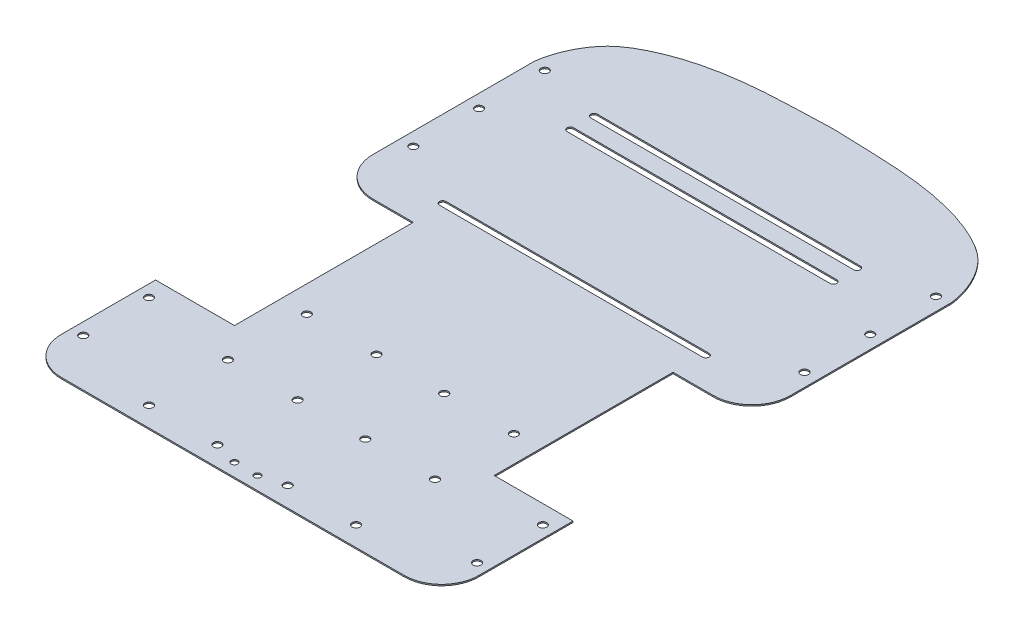
from build123d import *

# Parameters (mm, degrees)
SKETCH4_R           = 1.5
SKETCH4_R_2         = 1.25
BOSS_EXTRUDE2_DEPTH = 0.5


with BuildPart() as part:
    # Sketch4 → Boss-Extrude2 (new body)
    with BuildSketch(Plane(origin=(0, 0, 0), x_dir=(1, 0, 0), z_dir=(0, 1, 0))):
        with BuildLine():
            Line((0, 128.6), (0, 0))
            Line((0, 0), (-65.208953904, 0))
            ThreePointArc((-65.208953904, 0), (-75.225861161, 4.149138839), (-79.375, 14.166046096))
            Line((-79.375, 14.166046096), (-79.375, 50))
            Line((-79.375, 50), (-49.375, 50))
            Line((-49.375, 50), (-49.375, 118))
            Line((-49.375, 118), (-64.675, 118))
            ThreePointArc((-64.675, 118), (-75.069469683, 122.305530317), (-79.375, 132.7))
            Line((-79.375, 132.7), (-79.375, 193.786049975))
            add(Edge.make_bspline(
                [(-79.375, 193.786049975), (-78.783979858, 199.964089634), (-73.952599984, 211.643726286), (-54.660456042, 223.601842558), (-29.545703417, 228.182905558), (-9.188135392, 228.171492971), (0, 228.6)],
                knots=[0, 0, 0, 0, 0.226113446, 0.328670148, 0.719907193, 1, 1, 1, 1], degree=3))
            Line((0, 228.6), (0, 188.6))
            Line((0, 188.6), (-50, 188.6))
            ThreePointArc((-50, 188.6), (-51.25, 187.35), (-50, 186.1))
            Line((-50, 186.1), (0, 186.1))
            Line((0, 186.1), (0, 179.6))
            Line((0, 179.6), (-50, 179.6))
            ThreePointArc((-50, 179.6), (-51.25, 178.35), (-50, 177.1))
            Line((-50, 177.1), (0, 177.1))
            Line((0, 177.1), (0, 131.1))
            Line((0, 131.1), (-50, 131.1))
            ThreePointArc((-50, 131.1), (-51.25, 129.85), (-50, 128.6))
            Line((-50, 128.6), (0, 128.6))
        make_face()
        with Locations(Location((-74.875, 43, 0), (0, 0, 270))):
            Circle(SKETCH4_R, mode=Mode.SUBTRACT)
        with Locations(Location((-74.875, 18, 0), (0, 0, 270))):
            Circle(SKETCH4_R, mode=Mode.SUBTRACT)
        with Locations(Location((-39.375, 7.5, 0), (0, 0, 270))):
            Circle(SKETCH4_R, mode=Mode.SUBTRACT)
        with Locations(Location((-13.375, 7.5, 0), (0, 0, 270))):
            Circle(SKETCH4_R, mode=Mode.SUBTRACT)
        with Locations(Location((-4.375, 5, 0), (0, 0, 270))):
            Circle(SKETCH4_R_2, mode=Mode.SUBTRACT)
        with Locations(Location((-74.375, 143, 0), (0, 0, 270))):
            Circle(SKETCH4_R, mode=Mode.SUBTRACT)
        with Locations(Location((-74.375, 168, 0), (0, 0, 270))):
            Circle(SKETCH4_R, mode=Mode.SUBTRACT)
        with Locations(Location((-74.375, 193, 0), (0, 0, 270))):
            Circle(SKETCH4_R, mode=Mode.SUBTRACT)
        with Locations(Location((-39.375, 37.5, 0), (0, 0, 270))):
            Circle(SKETCH4_R, mode=Mode.SUBTRACT)
        with Locations(Location((-39.375, 67.5, 0), (0, 0, 270))):
            Circle(SKETCH4_R, mode=Mode.SUBTRACT)
        with Locations(Location((-12.875, 37.5, 0), (0, 0, 270))):
            Circle(SKETCH4_R, mode=Mode.SUBTRACT)
        with Locations(Location((-12.875, 67.5, 0), (0, 0, 270))):
            Circle(SKETCH4_R, mode=Mode.SUBTRACT)
    boss_extrude2 = extrude(amount=BOSS_EXTRUDE2_DEPTH)

    # Mirror4: part across plane


with BuildPart() as part_1:
    add(part.part)
    add(part.part.mirror(Plane(origin=(0, 0.5, -177.1), x_dir=(0, 0, 1), z_dir=(-1, 0, 0))))


with BuildPart() as mirror2_1:
    # Mirror2: Boss-Extrude2 across Right Plane
    add(boss_extrude2.mirror(Plane(origin=(0, 0, 0), x_dir=(0, 0, -1), z_dir=(1, 0, 0))))


with BuildPart() as part_2:
    add(part_1.part)

    # Mirror2 united with what the copies touc: union Mirror2_1
    add(mirror2_1.part)


solid = part_2.part
